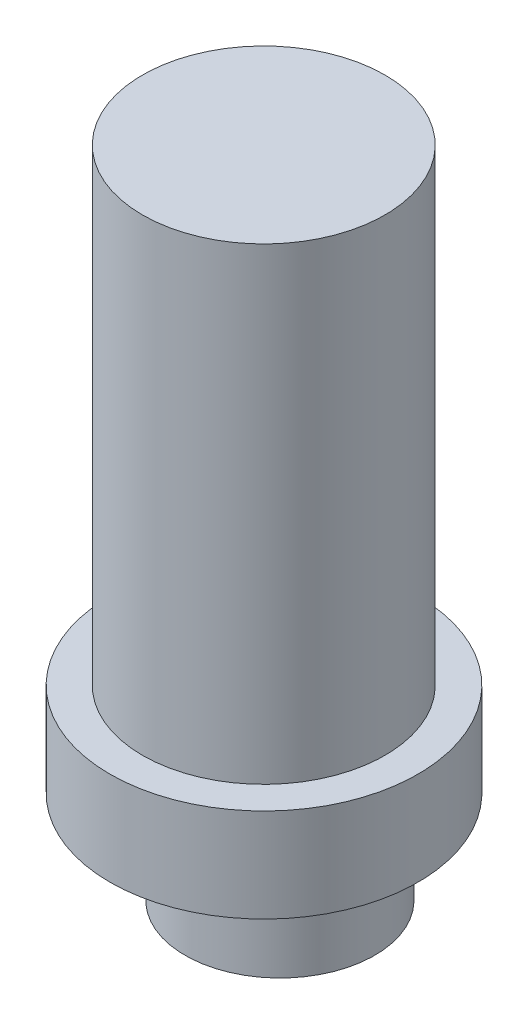
from build123d import *

# Parameters (mm, degrees)
SKETCH1_R           = 16.457903775
BOSS_EXTRUDE1_DEPTH = 10
SKETCH2_R           = 12.953549685
BOSS_EXTRUDE2_DEPTH = 50
SKETCH3_R           = 10.13009319
BOSS_EXTRUDE3_DEPTH = 10


with BuildPart() as part:
    # Sketch1 → Boss-Extrude1 (new body)
    with BuildSketch(Plane(origin=(0, 0, 0), x_dir=(1, 0, 0), z_dir=(0, 1, 0))):
        with Locations(Location((0, 1.800880605, 0), (0, 0, 270))):
            Circle(SKETCH1_R)
    extrude(amount=BOSS_EXTRUDE1_DEPTH)

    # Sketch2 → Boss-Extrude2 (add)
    with BuildSketch(Plane(origin=(0, 10, 0), x_dir=(1, 0, 0), z_dir=(0, 1, 0))):
        with Locations(Location((0, 1.773449881, 0), (0, 0, 270))):
            Circle(SKETCH2_R)
    extrude(amount=BOSS_EXTRUDE2_DEPTH)

    # Sketch3 → Boss-Extrude3 (add)
    with BuildSketch(Plane(origin=(0, 0, 0), x_dir=(-1, 0, 0), z_dir=(0, -1, 0))):
        with Locations(Location((-0.780000356, 2.718492372, 0), (0, 0, 90))):
            Circle(SKETCH3_R)
    extrude(amount=BOSS_EXTRUDE3_DEPTH)


solid = part.part
